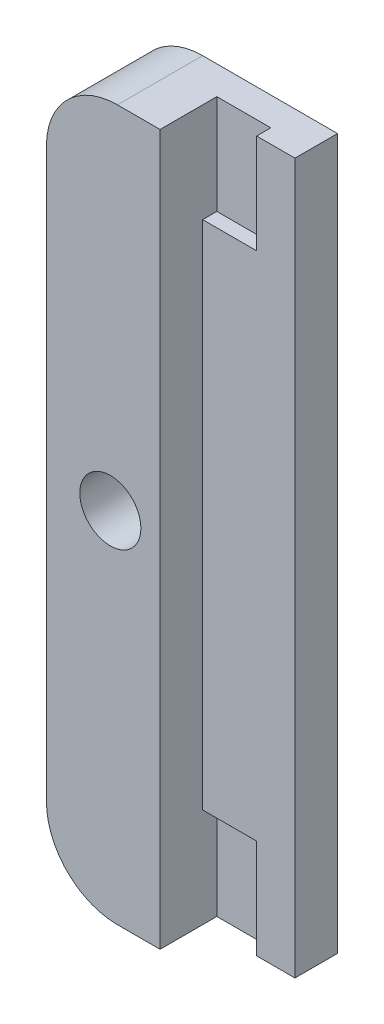
from build123d import *

# Parameters (mm, degrees)
CROQUIS1_W              = 14.5
CROQUIS1_H              = 50
CROQUIS1_R              = 2.15
SALIENTE_EXTRUIR1_DEPTH = 6
CROQUIS3_W              = 6.5
CROQUIS3_H              = 3
CORTAR_EXTRUIR1_DEPTH   = 50
CROQUIS4_W              = 3.8
CROQUIS4_H              = 1
CORTAR_EXTRUIR2_DEPTH   = 7
CORTAR_EXTRUIR3_START   = -50
CROQUIS4_2_W            = 3.8
CROQUIS4_2_H            = 1
CORTAR_EXTRUIR3_DEPTH   = 7
REDONDEO1_R             = 5


with BuildPart() as part:
    # Croquis1 → Saliente-Extruir1 (new body)
    with BuildSketch(Plane.XY):
        with Locations((2.75, 0)):
            Rectangle(CROQUIS1_W, CROQUIS1_H)
        Circle(CROQUIS1_R, mode=Mode.SUBTRACT)
    extrude(amount=SALIENTE_EXTRUIR1_DEPTH)

    # Croquis3 → Cortar-Extruir1 (cut)
    with BuildSketch(Plane.XZ.offset(25)):
        with Locations((6.75, 4.5)):
            Rectangle(CROQUIS3_W, CROQUIS3_H)
    extrude(amount=-CORTAR_EXTRUIR1_DEPTH, mode=Mode.SUBTRACT)

    # Croquis4 → Cortar-Extruir2 (cut)
    with BuildSketch(Plane(origin=(0, 25, 0), x_dir=(1, 0, 0), z_dir=(0, 1, 0))):
        with Locations((5.4, -2.5)):
            Rectangle(CROQUIS4_W, CROQUIS4_H)
    extrude(amount=-CORTAR_EXTRUIR2_DEPTH, mode=Mode.SUBTRACT)

    # Croquis4<2> → Cortar-Extruir3 (cut)
    with BuildSketch(Plane(origin=(0, 25, 0), x_dir=(1, 0, 0), z_dir=(0, 1, 0)).offset(CORTAR_EXTRUIR3_START)):
        with Locations((5.4, -2.5)):
            Rectangle(CROQUIS4_2_W, CROQUIS4_2_H)
    extrude(amount=CORTAR_EXTRUIR3_DEPTH, mode=Mode.SUBTRACT)

    # Redondeo1
    redondeo1_edges = [part.edges().sort_by_distance(p)[0] for p in [
        (-4.5, 25, 3),
        (-4.5, -25, 3),
    ]]
    fillet(redondeo1_edges, radius=REDONDEO1_R)


solid = part.part
